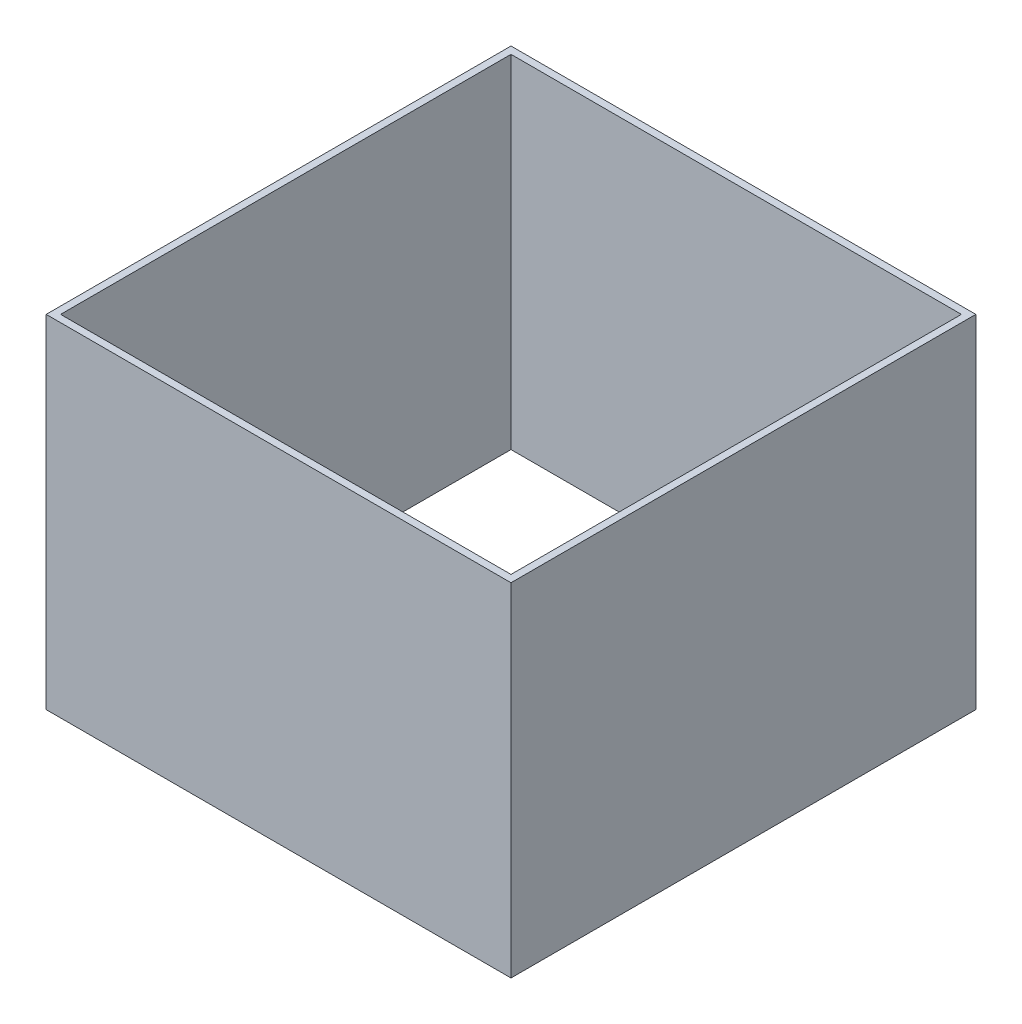
from build123d import *

# Parameters (mm, degrees)
SKETCH1_W           = 258
SKETCH1_H           = 258
SKETCH1_W_2         = 250
SKETCH1_H_2         = 250
BOSS_EXTRUDE1_DEPTH = 190


with BuildPart() as part:
    # Sketch1 → Boss-Extrude1 (new body)
    with BuildSketch(Plane(origin=(0, 0, 0), x_dir=(1, 0, 0), z_dir=(0, 1, 0))):
        Rectangle(SKETCH1_W, SKETCH1_H)
        Rectangle(SKETCH1_W_2, SKETCH1_H_2, mode=Mode.SUBTRACT)
    extrude(amount=BOSS_EXTRUDE1_DEPTH)


solid = part.part
